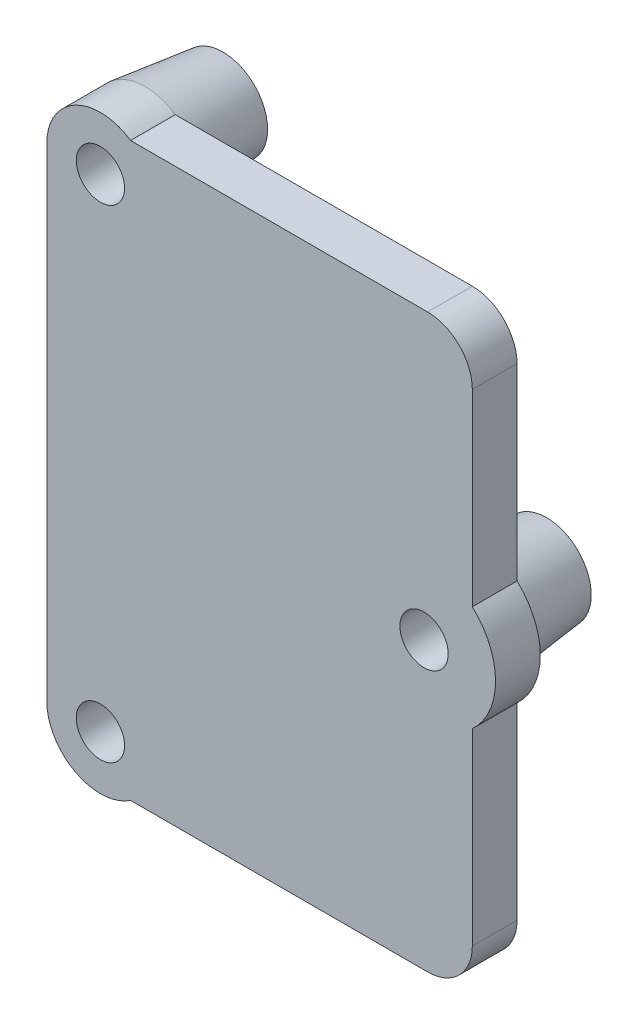
from build123d import *

# Parameters (mm, degrees)
SKETCH_1_R          = 2.2
SKETCH_1_R_2        = 2.7
EXTRUDE_1_DEPTH     = 5
CUT_EXTRUDE_1_REACH = 59.46
EXTRUDE_START       = -5
SKETCH_6_R          = 2.7
EXTRUDE_3_DEPTH     = 5
FILLET_1_R          = 5


with BuildPart() as part:
    # 草图1 → 凸台-拉伸1 (new body)
    with BuildSketch(Plane.XY):
        with BuildLine():
            Line((-21.928513003, 31.619793089), (-45, 12.5))
            Line((-45, 12.5), (-45, -12.5))
            Line((-45, -12.5), (-21.928513003, -31.619793089))
            ThreePointArc((-21.928513003, -31.619793089), (-18.386291168, -32.993165888), (-14.729286549, -31.963697294))
            Line((-14.729286549, -31.963697294), (22.594284602, -6.618263059))
            ThreePointArc((22.594284602, -6.618263059), (26.1, 0), (22.594284602, 6.618263059))
            Line((22.594284602, 6.618263059), (-14.729286549, 31.963697294))
            ThreePointArc((-14.729286549, 31.963697294), (-18.386291168, 32.993165888), (-21.928513003, 31.619793089))
        make_face()
        with Locations((-34.1, 0)):
            Circle(SKETCH_1_R, mode=Mode.SUBTRACT)
        with Locations((-18.1, 27)):
            Circle(SKETCH_1_R_2, mode=Mode.SUBTRACT)
        with Locations((-18.1, -27)):
            Circle(SKETCH_1_R_2, mode=Mode.SUBTRACT)
        with Locations((18.1, 0)):
            Circle(SKETCH_1_R_2, mode=Mode.SUBTRACT)
    extrude(amount=EXTRUDE_1_DEPTH)

    # 草图4 → 旋转1 (revolve)
    with BuildSketch(Plane(origin=(-24.93598604, 16.933358057, 0), x_dir=(0, 0, -1), z_dir=(0.8272828823621655, -0.5617855752425007, 0)), mode=Mode.PRIVATE) as revolve_1_sk:
        Polygon((8.7, 17.168318912), (8.7, 14.868318912), (0, 14.868318912), (0, 18.168318912), align=None)
    revolve_1 = revolve(revolve_1_sk.sketch.rotate(Axis((-18.1, 27, 1000.278995542), (0, 0, -1)), 55.820627671), axis=Axis((-18.1, 27, 1000.278995542), (0, 0, -1)))

    # 镜向1: 旋转1 across plane
    add(revolve_1.mirror(Plane.ZX))

    # 草图5 → 切除-拉伸1 (cut, up to next)
    with BuildSketch(Plane.XY.offset(5), mode=Mode.PRIVATE) as cut_extrude_1_sk1:
        with BuildLine():
            Line((-24.1, -27), (-24.1, 27))
            ThreePointArc((-24.1, 27), (-23.53005884, 29.552344215), (-21.928513003, 31.619793089))
            Line((-21.928513003, 31.619793089), (-45, 12.5))
            Line((-45, 12.5), (-45, -12.5))
            Line((-45, -12.5), (-21.928513003, -31.619793089))
            ThreePointArc((-21.928513003, -31.619793089), (-23.53005884, -29.552344215), (-24.1, -27))
        make_face()
    cut_extrude_1_tool1 = extrude(cut_extrude_1_sk1.sketch, amount=-CUT_EXTRUDE_1_REACH, mode=Mode.PRIVATE) & part.part
    add(cut_extrude_1_tool1.solids().sort_by_distance((-33.100815, 0, 5))[0], mode=Mode.SUBTRACT)

    # 草图6 → 凸台-拉伸3 (add)
    with BuildSketch(Plane.XY.offset(5).offset(EXTRUDE_START)):
        Polygon((12.5, -13.473020485), (-14.729286549, -31.963697294), (23.5, -31.963697294), (23.5, 31.963697294), (-14.729286549, 31.963697294), (12.5, 13.473020485), align=None)
        with Locations((18.1, 0)):
            Circle(SKETCH_6_R, mode=Mode.SUBTRACT)
    extrude(amount=EXTRUDE_3_DEPTH)

    # 草图7 → 旋转2 (revolve)
    with BuildSketch(Plane(origin=(6.469864276, 8.674410623, 0), x_dir=(0.8015915013283047, -0.5978721142503927, 0), z_dir=(0.5978721142503927, 0.8015915013283047, 0)), mode=Mode.PRIVATE) as revolve_2_sk:
        Polygon((11.808806174, 8.7), (11.808806174, 0), (8.508806174, 0), (9.508806174, 8.7), align=None)
    revolve(revolve_2_sk.sketch.rotate(Axis((18.1, 0, 1), (0, 0, -1)), 143.282349417), axis=Axis((18.1, 0, 1), (0, 0, -1)))

    # 圆角1
    fillet_1_edges = [part.edges().sort_by_distance(p)[0] for p in [
        (23.5, 31.963697294, 2.5),
        (23.5, -31.963697294, 2.5),
    ]]
    fillet(fillet_1_edges, radius=FILLET_1_R)


solid = part.part
